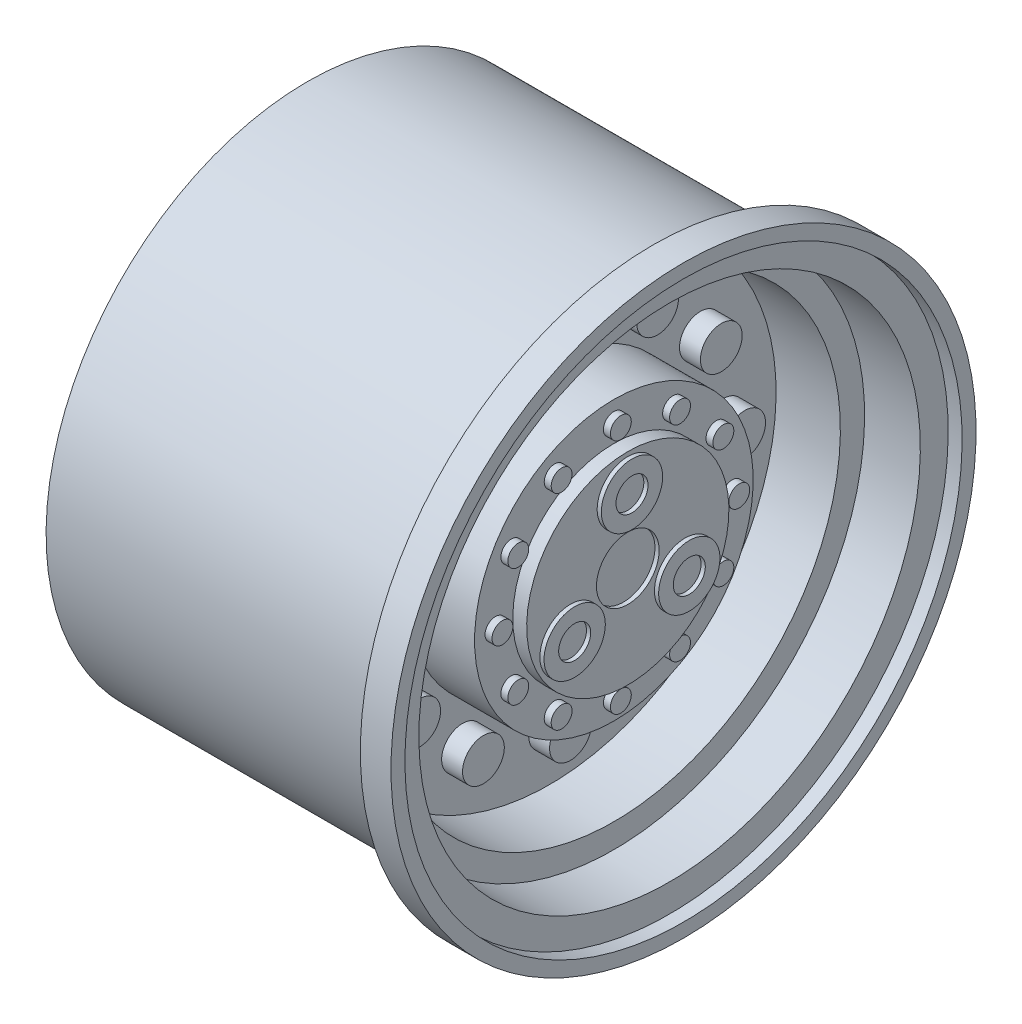
from build123d import *

# Parameters (mm, degrees)
SKETCH2_R           = 0.75
BOSS_EXTRUDE1_DEPTH = 0.75
SKETCH3_R           = 0.375
BOSS_EXTRUDE2_DEPTH = 0.25
SKETCH5_R           = 1.125
CUT_EXTRUDE1_DEPTH  = 0.15
SKETCH6_R           = 1.1
SKETCH6_R_2         = 0.575
BOSS_EXTRUDE3_DEPTH = 0.15
SKETCH7_R           = 0.375
BOSS_EXTRUDE4_DEPTH = 0.25
SKETCH8_R           = 1.25
CUT_EXTRUDE2_DEPTH  = 5


with BuildPart() as part:
    # Sketch1 → Revolve1 (revolve)
    with BuildSketch(Plane.XY):
        Polygon((3.75, 0), (0, 0), (-5.5, 0), (-5.5, 3.25), (-4.75, 3.25), (-4.75, 4.5), (-3.85, 4.5), (-3.85, 8.13), (-6.25, 8.13), (-6.25, 8.5), (-7.75, 8.5), (-7.75, 9.38), (0, 9.38), (4.65, 9.38), (4.65, 10.5), (5.75, 10.5), (5.75, 10), (5.25, 10), (5.25, 9), (3.25, 9), (3.25, 8.13), (0.943, 8.13), (0.943, 5), (3.25, 5), (3.25, 3.63), (3.75, 3.63), align=None)
    revolve(axis=Axis((0, 0, 0), (-1, 0, 0)))

    # Sketch2 → Boss-Extrude1 (add)
    with BuildSketch(Plane(origin=(0.943, 0, 0), x_dir=(0, 0, -1), z_dir=(1, 0, 0))):
        with Locations(Location((0, 6.25, 0), (0, 0, 90))):
            Circle(SKETCH2_R)
        with Locations(Location((3.125, 5.412658774, 0), (0, 0, 90))):
            Circle(SKETCH2_R)
        with Locations(Location((5.412658774, 3.125, 0), (0, 0, 90))):
            Circle(SKETCH2_R)
        with Locations(Location((6.25, 0, 0), (0, 0, 90))):
            Circle(SKETCH2_R)
        with Locations(Location((5.412658774, -3.125, 0), (0, 0, 90))):
            Circle(SKETCH2_R)
        with Locations(Location((3.125, -5.412658774, 0), (0, 0, 90))):
            Circle(SKETCH2_R)
        with Locations(Location((0, -6.25, 0), (0, 0, 90))):
            Circle(SKETCH2_R)
        with Locations(Location((-3.125, -5.412658774, 0), (0, 0, 90))):
            Circle(SKETCH2_R)
        with Locations(Location((-5.412658774, -3.125, 0), (0, 0, 90))):
            Circle(SKETCH2_R)
        with Locations(Location((-6.25, 0, 0), (0, 0, 90))):
            Circle(SKETCH2_R)
        with Locations(Location((-5.412658774, 3.125, 0), (0, 0, 90))):
            Circle(SKETCH2_R)
        with Locations(Location((-3.125, 5.412658774, 0), (0, 0, 90))):
            Circle(SKETCH2_R)
    extrude(amount=BOSS_EXTRUDE1_DEPTH)

    # Sketch3 → Boss-Extrude2 (add)
    with BuildSketch(Plane(origin=(3.25, 0, 0), x_dir=(0, 0, -1), z_dir=(1, 0, 0))):
        with Locations(Location((0, 4.25, 0), (0, 0, 90))):
            Circle(SKETCH3_R)
        with Locations(Location((2.125, 3.680607966, 0), (0, 0, 90))):
            Circle(SKETCH3_R)
        with Locations(Location((3.680607966, 2.125, 0), (0, 0, 90))):
            Circle(SKETCH3_R)
        with Locations(Location((4.25, 0, 0), (0, 0, 90))):
            Circle(SKETCH3_R)
        with Locations(Location((3.680607966, -2.125, 0), (0, 0, 90))):
            Circle(SKETCH3_R)
        with Locations(Location((2.125, -3.680607966, 0), (0, 0, 90))):
            Circle(SKETCH3_R)
        with Locations(Location((0, -4.25, 0), (0, 0, 90))):
            Circle(SKETCH3_R)
        with Locations(Location((-2.125, -3.680607966, 0), (0, 0, 90))):
            Circle(SKETCH3_R)
        with Locations(Location((-3.680607966, -2.125, 0), (0, 0, 90))):
            Circle(SKETCH3_R)
        with Locations(Location((-4.25, 0, 0), (0, 0, 90))):
            Circle(SKETCH3_R)
        with Locations(Location((-3.680607966, 2.125, 0), (0, 0, 90))):
            Circle(SKETCH3_R)
        with Locations(Location((-2.125, 3.680607966, 0), (0, 0, 90))):
            Circle(SKETCH3_R)
    extrude(amount=BOSS_EXTRUDE2_DEPTH)

    # Sketch5 → Cut-Extrude1 (cut)
    with BuildSketch(Plane(origin=(3.75, 0, 0), x_dir=(0, 0, -1), z_dir=(1, 0, 0))):
        with Locations(Location((0, 0, 0), (0, 0, 90))):
            Circle(SKETCH5_R)
    extrude(amount=-CUT_EXTRUDE1_DEPTH, mode=Mode.SUBTRACT)

    # Sketch6 → Boss-Extrude3 (add)
    # profile 1 of 3: a face of its own
    with BuildSketch(Plane(origin=(3.75, 0, 0), x_dir=(0, 0, -1), z_dir=(1, 0, 0))):
        with Locations(Location((0, 2.375, 0), (0, 0, 90))):
            Circle(SKETCH6_R)
        with Locations(Location((0, 2.375, 0), (0, 0, 90))):
            Circle(SKETCH6_R_2, mode=Mode.SUBTRACT)
    # profile 2 of 3: a face of its own
    with BuildSketch(Plane(origin=(3.75, 0, 0), x_dir=(0, 0, -1), z_dir=(1, 0, 0))):
        with Locations(Location((2.056810334, -1.1875, 0), (0, 0, 90))):
            Circle(SKETCH6_R)
        with Locations(Location((2.056810334, -1.1875, 0), (0, 0, 90))):
            Circle(SKETCH6_R_2, mode=Mode.SUBTRACT)
    # profile 3 of 3: a face of its own
    with BuildSketch(Plane(origin=(3.75, 0, 0), x_dir=(0, 0, -1), z_dir=(1, 0, 0))):
        with Locations(Location((-2.056810334, -1.1875, 0), (0, 0, 90))):
            Circle(SKETCH6_R)
        with Locations(Location((-2.056810334, -1.1875, 0), (0, 0, 90))):
            Circle(SKETCH6_R_2, mode=Mode.SUBTRACT)
    extrude(amount=BOSS_EXTRUDE3_DEPTH)

    # Sketch7 → Boss-Extrude4 (add)
    with BuildSketch(Plane.ZY.offset(4.75)):
        with Locations(Location((0, 3.81, 0), (0, 0, 270))):
            Circle(SKETCH7_R)
        with Locations(Location((1.905, 3.299556788, 0), (0, 0, 270))):
            Circle(SKETCH7_R)
        with Locations(Location((3.299556788, 1.905, 0), (0, 0, 270))):
            Circle(SKETCH7_R)
        with Locations(Location((3.81, 0, 0), (0, 0, 270))):
            Circle(SKETCH7_R)
        with Locations(Location((3.299556788, -1.905, 0), (0, 0, 270))):
            Circle(SKETCH7_R)
        with Locations(Location((1.905, -3.299556788, 0), (0, 0, 270))):
            Circle(SKETCH7_R)
        with Locations(Location((0, -3.81, 0), (0, 0, 270))):
            Circle(SKETCH7_R)
        with Locations(Location((-1.905, -3.299556788, 0), (0, 0, 270))):
            Circle(SKETCH7_R)
        with Locations(Location((-3.299556788, -1.905, 0), (0, 0, 270))):
            Circle(SKETCH7_R)
        with Locations(Location((-3.81, 0, 0), (0, 0, 270))):
            Circle(SKETCH7_R)
        with Locations(Location((-3.299556788, 1.905, 0), (0, 0, 270))):
            Circle(SKETCH7_R)
        with Locations(Location((-1.905, 3.299556788, 0), (0, 0, 270))):
            Circle(SKETCH7_R)
    extrude(amount=BOSS_EXTRUDE4_DEPTH)

    # Sketch8 → Cut-Extrude2 (cut)
    with BuildSketch(Plane.ZY.offset(5.5)):
        with Locations(Location((0, 0, 0), (0, 0, 270))):
            Circle(SKETCH8_R)
    extrude(amount=-CUT_EXTRUDE2_DEPTH, mode=Mode.SUBTRACT)


solid = part.part
